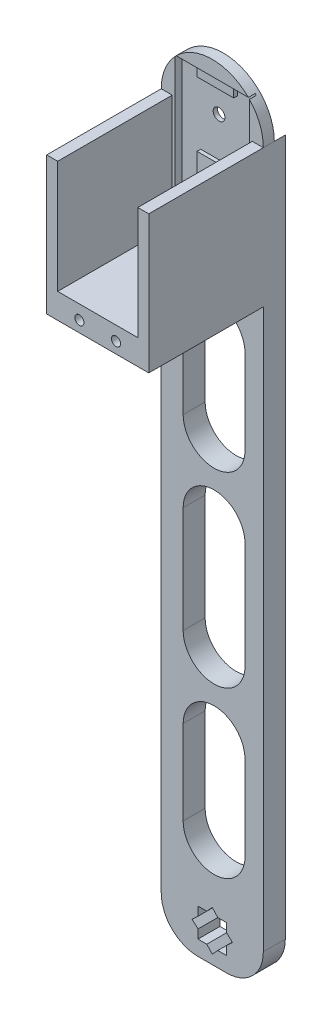
from build123d import *

# Parameters (mm, degrees)
ESQUISSE1_W             = 27.85
ESQUISSE1_H             = 200
BOSS_EXTRU_1_DEPTH      = 6
ESQUISSE4_W             = 7.790942256
ESQUISSE4_H             = 7.790942256
ESQUISSE4_R             = 3
ENL_V_MAT_EXTRU_3_DEPTH = 29
ESQUISSE5_R             = 13.925
ENL_V_MAT_EXTRU_4_DEPTH = 3
ESQUISSE7_W             = 16.87
ESQUISSE7_H             = 23
ESQUISSE7_H_2           = 29
ENL_V_MAT_EXTRU_6_DEPTH = 13
CONG_1_R                = 10
CONG_2_R                = 10
ESQUISSE8_R             = 1.6
ENL_V_MAT_EXTRU_7_DEPTH = 10
ESQUISSE11_W            = 20.3
ESQUISSE11_H            = 40.6
ENL_V_MAT_EXTRU_8_DEPTH = 1.85
ESQUISSE12_W            = 27.85
ESQUISSE12_H            = 6.85
BOSS_EXTRU_5_DEPTH      = 31.25
ESQUISSE14_W            = 10
ESQUISSE14_H            = 20
ESQUISSE14_H_2          = 3
BOSS_EXTRU_6_DEPTH      = 1
ESQUISSE15_W            = 3
ESQUISSE15_H            = 30.75
BOSS_EXTRU_7_DEPTH      = 31.25
TROU_TARAUD_M32_D       = 2.5
TROU_TARAUD_M32_DEPTH   = 8.5
TROU_TARAUD_M32_TIP     = 0.751075774


with BuildPart() as part:
    # Esquisse1 → Boss.-Extru.1 (new body)
    with BuildSketch(Plane.XY):
        with Locations((4.111190476, -68.237738095)):
            Rectangle(ESQUISSE1_W, ESQUISSE1_H)
        with BuildLine():
            Line((-9.813809524, 31.762261905), (18.036190476, 31.762261905))
            ThreePointArc((18.036190476, 31.762261905), (4.111190476, 45.687261905), (-9.813809524, 31.762261905))
        make_face()
    extrude(amount=BOSS_EXTRU_1_DEPTH)

    # Esquisse4 → Enlèv. mat.-Extru.3 (cut)
    # profile 1 of 9: a face of its own
    with BuildSketch(Plane.XY.offset(6)):
        Polygon((4.111190476, -154.728709994), (2.615719348, -156.342266967), (5.606661604, -156.342266967), align=None)
    # profile 2 of 9: a face of its own
    with BuildSketch(Plane.XY.offset(6)):
        with Locations((4.111190476, -160.237738095)):
            Rectangle(ESQUISSE4_W, ESQUISSE4_H)
        with Locations((4.111190476, -160.237738095)):
            Circle(ESQUISSE4_R, mode=Mode.SUBTRACT)
    # profile 3 of 9: a face of its own
    with BuildSketch(Plane.XY.offset(6)):
        Polygon((0.215719348, -161.733209223), (0.215719348, -158.742266967), (-1.397837625, -160.237738095), align=None)
    # profile 4 of 9: a face of its own
    with BuildSketch(Plane.XY.offset(6)):
        Polygon((5.606661604, -164.133209223), (2.615719348, -164.133209223), (4.111190476, -165.746766196), align=None)
    # profile 5 of 9: a face of its own
    with BuildSketch(Plane.XY.offset(6)):
        Polygon((9.620218577, -160.237738095), (8.006661604, -158.742266967), (8.006661604, -161.733209223), align=None)
    # profile 6 of 9: a face of its own
    with BuildSketch(Plane.XY.offset(6)):
        with BuildLine():
            ThreePointArc((7.111190476, -160.237738095), (4.887647611, -157.339960616), (1.513114265, -158.737738095))
            Line((1.513114265, -158.737738095), (1.513114265, -161.737738095))
            ThreePointArc((1.513114265, -161.737738095), (4.887647611, -163.135515574), (7.111190476, -160.237738095))
        make_face()
    # profile 7 of 9: a face of its own
    with BuildSketch(Plane.XY.offset(6)):
        with BuildLine():
            Line((1.513114265, -161.737738095), (1.513114265, -158.737738095))
            ThreePointArc((1.513114265, -158.737738095), (1.111190476, -160.237738095), (1.513114265, -161.737738095))
        make_face()
    # profile 8 of 9: a face of its own
    with BuildSketch(Plane.XY.offset(6)):
        with BuildLine():
            ThreePointArc((7.111190476, -160.237738095), (4.887647611, -157.339960616), (1.513114265, -158.737738095))
            Line((1.513114265, -158.737738095), (1.513114265, -161.737738095))
            ThreePointArc((1.513114265, -161.737738095), (4.887647611, -163.135515574), (7.111190476, -160.237738095))
        make_face()
    # profile 9 of 9: a face of its own
    with BuildSketch(Plane.XY.offset(6)):
        with BuildLine():
            Line((1.513114265, -161.737738095), (1.513114265, -158.737738095))
            ThreePointArc((1.513114265, -158.737738095), (1.111190476, -160.237738095), (1.513114265, -161.737738095))
        make_face()
    extrude(amount=-ENL_V_MAT_EXTRU_3_DEPTH, mode=Mode.SUBTRACT)

    # Esquisse5 → Enlèv. mat.-Extru.4 (cut)
    with BuildSketch(Plane(origin=(0, 0, 0), x_dir=(-1, 0, 0), z_dir=(0, 0, -1))):
        with Locations((-4.111190476, 31.762261905)):
            Circle(ESQUISSE5_R)
    extrude(amount=-ENL_V_MAT_EXTRU_4_DEPTH, mode=Mode.SUBTRACT)

    # Esquisse7 → Enlèv. mat.-Extru.6 (cut)
    with BuildSketch(Plane(origin=(0, 0, 0), x_dir=(-1, 0, 0), z_dir=(0, 0, -1))):
        with BuildLine():
            ThreePointArc((-13.036190476, -115.237738095), (-4.601190476, -106.802738095), (3.833809524, -115.237738095))
            Line((3.833809524, -115.237738095), (-13.036190476, -115.237738095))
        make_face()
        with Locations((-4.601190476, -126.737738095)):
            Rectangle(ESQUISSE7_W, ESQUISSE7_H)
        with BuildLine():
            Line((-13.036190476, -138.237738095), (3.833809524, -138.237738095))
            ThreePointArc((3.833809524, -138.237738095), (-4.601190476, -146.672738095), (-13.036190476, -138.237738095))
        make_face()
        with BuildLine():
            Line((3.833809524, -93.237738095), (-13.036190476, -93.237738095))
            ThreePointArc((-13.036190476, -93.237738095), (-4.601190476, -101.672738095), (3.833809524, -93.237738095))
        make_face()
        with Locations((-4.601190476, -78.737738095)):
            Rectangle(ESQUISSE7_W, ESQUISSE7_H_2)
        with BuildLine():
            Line((3.833809524, -64.237738095), (-13.036190476, -64.237738095))
            ThreePointArc((-13.036190476, -64.237738095), (-4.601190476, -55.802738095), (3.833809524, -64.237738095))
        make_face()
        with BuildLine():
            ThreePointArc((3.833809524, -42.237738095), (-4.601190476, -50.672738095), (-13.036190476, -42.237738095))
            Line((-13.036190476, -42.237738095), (3.833809524, -42.237738095))
        make_face()
        with Locations((-4.601190476, -30.737738095)):
            Rectangle(ESQUISSE7_W, ESQUISSE7_H)
        with BuildLine():
            Line((3.833809524, -19.237738095), (-13.036190476, -19.237738095))
            ThreePointArc((-13.036190476, -19.237738095), (-4.601190476, -10.802738095), (3.833809524, -19.237738095))
        make_face()
    extrude(amount=-ENL_V_MAT_EXTRU_6_DEPTH, mode=Mode.SUBTRACT)

    # Congé1
    cong_1_edges = [part.edges().sort_by_distance(p)[0] for p in [
        (18.036190476, -168.237738095, 3),
    ]]
    fillet(cong_1_edges, radius=CONG_1_R)

    # Congé2
    cong_2_edges = [part.edges().sort_by_distance(p)[0] for p in [
        (-9.813809524, -168.237738095, 3),
    ]]
    fillet(cong_2_edges, radius=CONG_2_R)

    # Esquisse8 → Enlèv. mat.-Extru.7 (cut)
    with BuildSketch(Plane(origin=(0, 0, 3), x_dir=(-1, 0, 0), z_dir=(0, 0, -1))):
        with Locations((-4.111190476, 31.762261905)):
            Circle(ESQUISSE8_R)
    extrude(amount=-ENL_V_MAT_EXTRU_7_DEPTH, mode=Mode.SUBTRACT)

    # Esquisse11 → Enlèv. mat.-Extru.8 (cut)
    with BuildSketch(Plane.XY.offset(6)):
        with Locations((4.111190476, 21.312261905)):
            Rectangle(ESQUISSE11_W, ESQUISSE11_H)
    extrude(amount=-ENL_V_MAT_EXTRU_8_DEPTH, mode=Mode.SUBTRACT)

    # Esquisse12 → Boss.-Extru.5 (add)
    with BuildSketch(Plane.XY.offset(6)):
        with Locations((4.111190476, -2.412738095)):
            Rectangle(ESQUISSE12_W, ESQUISSE12_H)
    extrude(amount=BOSS_EXTRU_5_DEPTH)

    # Esquisse14 → Boss.-Extru.6 (add)
    with BuildSketch(Plane.XY.offset(4.15)):
        with Locations((4.111190476, 11.012261905)):
            Rectangle(ESQUISSE14_W, ESQUISSE14_H)
        with Locations((4.111190476, 40.112261905)):
            Rectangle(ESQUISSE14_W, ESQUISSE14_H_2)
    extrude(amount=BOSS_EXTRU_6_DEPTH)

    # Esquisse15 → Boss.-Extru.7 (add)
    with BuildSketch(Plane.XY.offset(6)):
        with Locations((-8.313809524, 16.387261905)):
            Rectangle(ESQUISSE15_W, ESQUISSE15_H)
        with Locations((16.536190476, 16.387261905)):
            Rectangle(ESQUISSE15_W, ESQUISSE15_H)
    extrude(amount=BOSS_EXTRU_7_DEPTH)

    # Trou taraudé M32
    with Locations(Plane.XY.offset(37.25)):
        with Locations((-0.893809524, -2.807738095), (9.106190476, -2.807738095)):
            Hole(TROU_TARAUD_M32_D / 2, depth=TROU_TARAUD_M32_DEPTH)
            with Locations((0, 0, -(TROU_TARAUD_M32_DEPTH + TROU_TARAUD_M32_TIP / 2))):  # 118° drill point
                Cone(0, TROU_TARAUD_M32_D / 2, TROU_TARAUD_M32_TIP, mode=Mode.SUBTRACT)


solid = part.part
